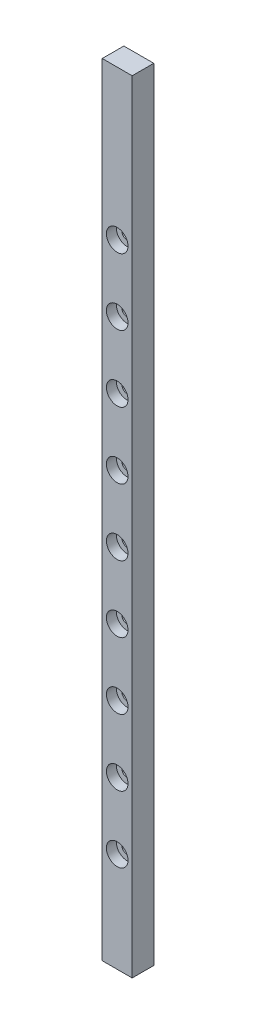
from build123d import *

# Parameters (mm, degrees)
SKETCH_1_W          = 9
SKETCH_1_H          = 250
EXTRUDE_1_DEPTH     = 6.5
SKETCH_2_R          = 1.6
CUT_EXTRUDE_1_DEPTH = 126.249750499
SKETCH_3_R          = 3.25
CUT_EXTRUDE_2_DEPTH = 3
SKETCH_4_W          = 6.5
SKETCH_4_H          = 15
CUT_EXTRUDE_3_DEPTH = 10


with BuildPart() as part:
    # 草图1 → 凸台-拉伸1 (new body)
    with BuildSketch(Plane.XY):
        Rectangle(SKETCH_1_W, SKETCH_1_H)
    extrude(amount=EXTRUDE_1_DEPTH)

    # 草图2 → 切除-拉伸1 (cut, through all)
    with BuildSketch(Plane.XY.offset(6.5)):
        Circle(SKETCH_2_R)
        with Locations((0, 20)):
            Circle(SKETCH_2_R)
        with Locations((0, 40)):
            Circle(SKETCH_2_R)
        with Locations((0, 60)):
            Circle(SKETCH_2_R)
        with Locations((0, 80)):
            Circle(SKETCH_2_R)
        with Locations((0, -20)):
            Circle(SKETCH_2_R)
        with Locations((0, -40)):
            Circle(SKETCH_2_R)
        with Locations((0, -60)):
            Circle(SKETCH_2_R)
        with Locations((0, -80)):
            Circle(SKETCH_2_R)
    extrude(amount=-CUT_EXTRUDE_1_DEPTH, mode=Mode.SUBTRACT)

    # 草图3 → 切除-拉伸2 (cut)
    with BuildSketch(Plane.XY.offset(6.5)):
        with Locations((0, 80)):
            Circle(SKETCH_3_R)
        with Locations((0, 60)):
            Circle(SKETCH_3_R)
        with Locations((0, 40)):
            Circle(SKETCH_3_R)
        with Locations((0, 20)):
            Circle(SKETCH_3_R)
        Circle(SKETCH_3_R)
        with Locations((0, -20)):
            Circle(SKETCH_3_R)
        with Locations((0, -40)):
            Circle(SKETCH_3_R)
        with Locations((0, -60)):
            Circle(SKETCH_3_R)
        with Locations((0, -80)):
            Circle(SKETCH_3_R)
    extrude(amount=-CUT_EXTRUDE_2_DEPTH, mode=Mode.SUBTRACT)

    # 草图4 → 切除-拉伸3 (cut)
    with BuildSketch(Plane.ZY.offset(4.5)):
        with Locations((3.25, -117.5)):
            Rectangle(SKETCH_4_W, SKETCH_4_H)
    extrude(amount=-CUT_EXTRUDE_3_DEPTH, mode=Mode.SUBTRACT)


solid = part.part
